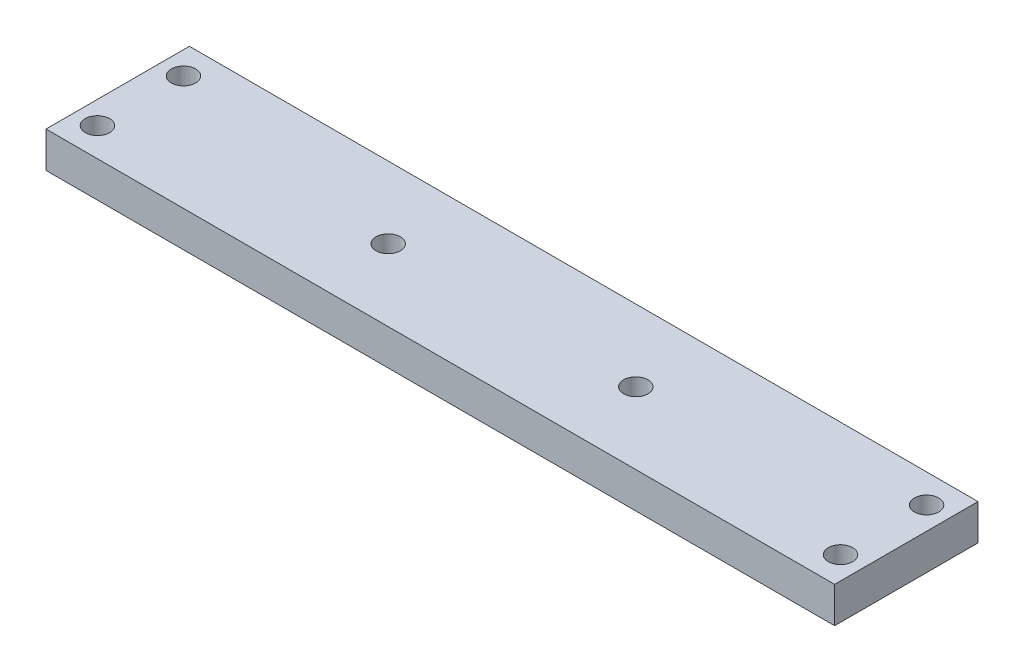
from build123d import *

# Parameters (mm, degrees)
SKETCH1_W            = 110
SKETCH1_H            = 20
BOSS_EXTRUDE1_DEPTH  = 2.5
M3_CLEARANCE_HOLE1_D = 3.4


with BuildPart() as part:
    # Sketch1 → Boss-Extrude1 (new, symmetric)
    with BuildSketch(Plane(origin=(0, 0, 0), x_dir=(1, 0, 0), z_dir=(0, 1, 0))):
        Rectangle(SKETCH1_W, SKETCH1_H)
    extrude(amount=BOSS_EXTRUDE1_DEPTH, both=True)

    # M3 Clearance Hole1 (through all)
    with Locations(Plane(origin=(0, 2.5, 0), x_dir=(1, 0, 0), z_dir=(0, 1, 0))):
        with Locations((-17.275, 0), (-51.825, -6), (51.825, -6), (-51.825, 6), (51.825, 6), (17.275, 0)):
            Hole(M3_CLEARANCE_HOLE1_D / 2)


solid = part.part
